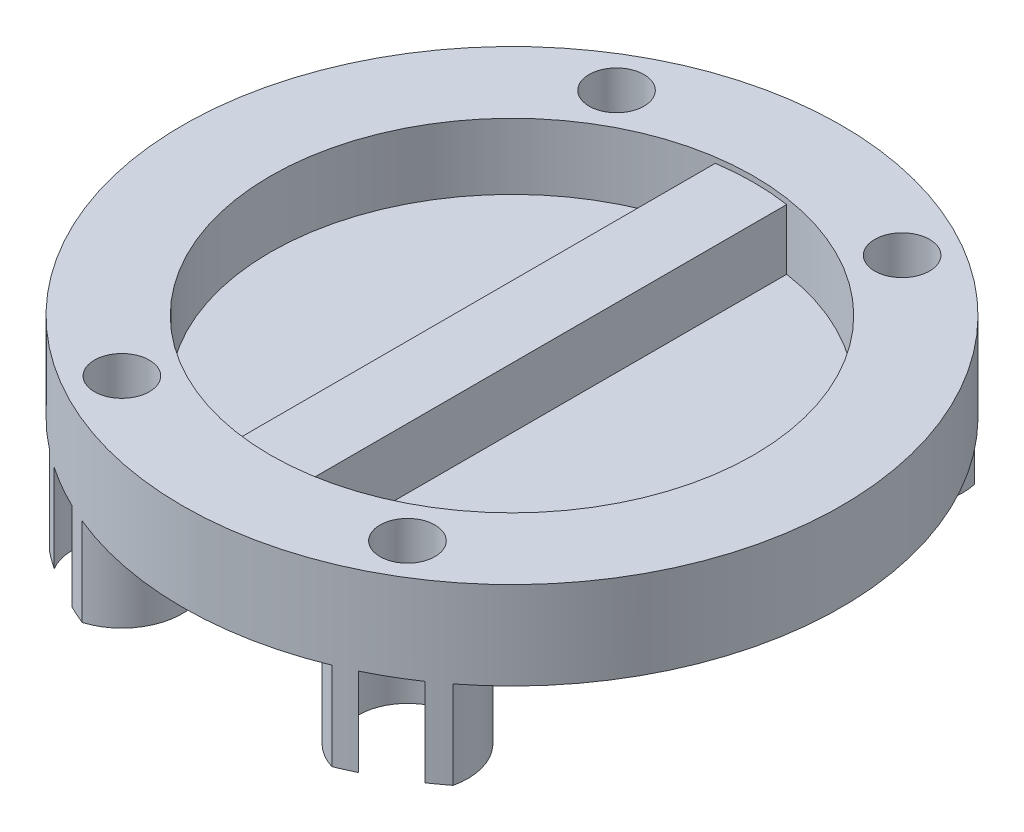
from build123d import *

# Parameters (mm, degrees)
SKETCH_1_R          = 17.6
EXTRUDE_1_DEPTH     = 1.6
SKETCH_1_4_W        = 5.2
SKETCH_1_4_H        = 42.4
EXTRUDE_2_DEPTH     = 6
SKETCH_1_7_R        = 24
SKETCH_1_7_R_2      = 17.6
SKETCH_1_7_R_3      = 2
EXTRUDE_3_DEPTH     = 6.4
EXTRUDE_START       = -6.4
EXTRUDE_4_DEPTH     = 6.4
SKETCH_1_5_W        = 2
SKETCH_1_5_H        = 39.2
CUT_EXTRUDE_1_DEPTH = 2.8


with BuildPart() as part:
    # 草圖1 → 填料-伸長1 (new body)
    with BuildSketch(Plane(origin=(0, 0, 0), x_dir=(1, 0, 0), z_dir=(0, 1, 0))):
        Circle(SKETCH_1_R)
    extrude(amount=EXTRUDE_1_DEPTH)

    # 草圖1<4> → 填料-伸長2 (add)
    with BuildSketch(Plane(origin=(0, 0, 0), x_dir=(1, 0, 0), z_dir=(0, 1, 0))):
        Rectangle(SKETCH_1_4_W, SKETCH_1_4_H)
    extrude(amount=EXTRUDE_2_DEPTH)

    # 草圖1<7> → 填料-伸長3 (add)
    with BuildSketch(Plane(origin=(0, 0, 0), x_dir=(1, 0, 0), z_dir=(0, 1, 0))):
        Circle(SKETCH_1_7_R)
        Circle(SKETCH_1_7_R_2, mode=Mode.SUBTRACT)
        with Locations((-10.4, 18.013328399)):
            Circle(SKETCH_1_7_R_3, mode=Mode.SUBTRACT)
        with Locations((10.4, 18.013328399)):
            Circle(SKETCH_1_7_R_3, mode=Mode.SUBTRACT)
        with Locations((10.4, -18.013328399)):
            Circle(SKETCH_1_7_R_3, mode=Mode.SUBTRACT)
        with Locations((-10.4, -18.013328399)):
            Circle(SKETCH_1_7_R_3, mode=Mode.SUBTRACT)
    extrude(amount=EXTRUDE_3_DEPTH)

    # 草圖1<9> → 填料-伸長4 (add)
    with BuildSketch(Plane(origin=(0, 0, 0), x_dir=(1, 0, 0), z_dir=(0, 1, 0)).offset(EXTRUDE_START)):
        with BuildLine():
            ThreePointArc((-13.500487327, 19.842803278), (-14.103540299, 19.418809207), (-14.693286878, 18.976493899))
            ThreePointArc((-14.693286878, 18.976493899), (-8.2, 14.202816622), (-9.087482353, 22.213006651))
            ThreePointArc((-9.087482353, 22.213006651), (-9.765411935, 21.923428786), (-10.434128057, 21.613166628))
            ThreePointArc((-10.434128057, 21.613166628), (-8.6, 14.895636945), (-13.500487327, 19.842803278))
        make_face()
        with BuildLine():
            ThreePointArc((14.693286878, 18.976493899), (14.103540299, 19.418809207), (13.500487327, 19.842803278))
            ThreePointArc((13.500487327, 19.842803278), (8.6, 14.895636945), (10.434128057, 21.613166628))
            ThreePointArc((10.434128057, 21.613166628), (9.765411935, 21.923428786), (9.087482353, 22.213006651))
            ThreePointArc((9.087482353, 22.213006651), (8.2, 14.202816622), (14.693286878, 18.976493899))
        make_face()
        with BuildLine():
            ThreePointArc((-14.693286878, -18.976493899), (-14.103540299, -19.418809207), (-13.500487327, -19.842803278))
            ThreePointArc((-13.500487327, -19.842803278), (-8.6, -14.895636945), (-10.434128057, -21.613166628))
            ThreePointArc((-10.434128057, -21.613166628), (-9.765411935, -21.923428786), (-9.087482353, -22.213006651))
            ThreePointArc((-9.087482353, -22.213006651), (-8.2, -14.202816622), (-14.693286878, -18.976493899))
        make_face()
        with BuildLine():
            ThreePointArc((9.087482353, -22.213006651), (9.765411935, -21.923428786), (10.434128057, -21.613166628))
            ThreePointArc((10.434128057, -21.613166628), (8.6, -14.895636945), (13.500487327, -19.842803278))
            ThreePointArc((13.500487327, -19.842803278), (14.103540299, -19.418809207), (14.693286878, -18.976493899))
            ThreePointArc((14.693286878, -18.976493899), (8.2, -14.202816622), (9.087482353, -22.213006651))
        make_face()
    extrude(amount=EXTRUDE_4_DEPTH)

    # 草圖1<5> → 除料-伸長1 (cut)
    with BuildSketch(Plane(origin=(0, 0, 0), x_dir=(1, 0, 0), z_dir=(0, 1, 0))):
        Rectangle(SKETCH_1_5_W, SKETCH_1_5_H)
    extrude(amount=CUT_EXTRUDE_1_DEPTH, mode=Mode.SUBTRACT)


solid = part.part
